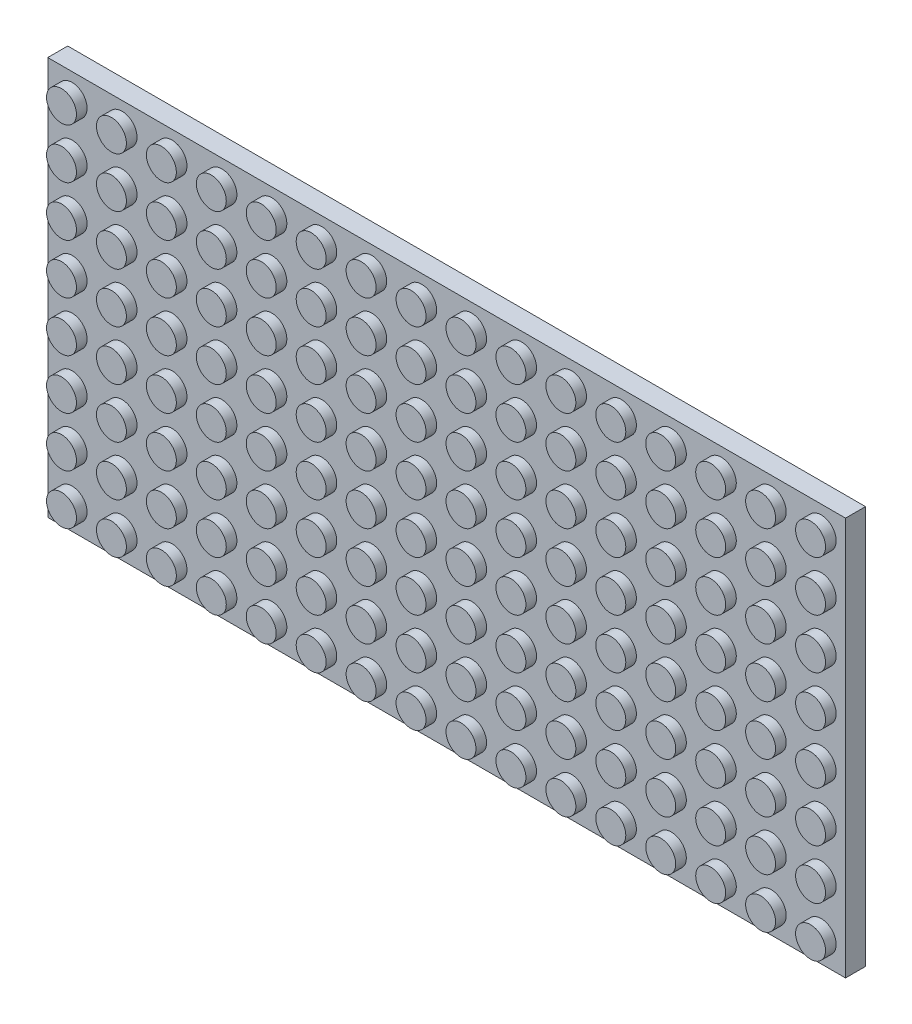
from build123d import *

# Parameters (mm, degrees)
SKETCH_1_W          = 127.8
SKETCH_1_H          = 63.8
EXTRUDE_1_DEPTH     = 3.2
SKETCH_2_R          = 2.4
EXTRUDE_2_DEPTH     = 1.7
SKETCH_3_R          = 2.5
CUT_EXTRUDE_1_DEPTH = 1.8


with BuildPart() as part:
    # Эскиз1 → Бобышка-Вытянуть1 (new body)
    with BuildSketch(Plane.XY):
        Rectangle(SKETCH_1_W, SKETCH_1_H)
    extrude(amount=EXTRUDE_1_DEPTH)

    # Эскиз2 → Бобышка-Вытянуть2 (add)
    with BuildSketch(Plane.XY.offset(3.2)):
        with Locations(Location((-60, 28, 0), (0, 0, 180))):
            Circle(SKETCH_2_R)
        with Locations(Location((-52, 28, 0), (0, 0, 180))):
            Circle(SKETCH_2_R)
        with Locations(Location((-44, 28, 0), (0, 0, 180))):
            Circle(SKETCH_2_R)
        with Locations(Location((-36, 28, 0), (0, 0, 180))):
            Circle(SKETCH_2_R)
        with Locations(Location((-28, 28, 0), (0, 0, 180))):
            Circle(SKETCH_2_R)
        with Locations(Location((-20, 28, 0), (0, 0, 180))):
            Circle(SKETCH_2_R)
        with Locations(Location((-12, 28, 0), (0, 0, 180))):
            Circle(SKETCH_2_R)
        with Locations(Location((-4, 28, 0), (0, 0, 180))):
            Circle(SKETCH_2_R)
        with Locations(Location((4, 28, 0), (0, 0, 180))):
            Circle(SKETCH_2_R)
        with Locations(Location((12, 28, 0), (0, 0, 180))):
            Circle(SKETCH_2_R)
        with Locations(Location((20, 28, 0), (0, 0, 180))):
            Circle(SKETCH_2_R)
        with Locations(Location((28, 28, 0), (0, 0, 180))):
            Circle(SKETCH_2_R)
        with Locations(Location((36, 28, 0), (0, 0, 180))):
            Circle(SKETCH_2_R)
        with Locations(Location((44, 28, 0), (0, 0, 180))):
            Circle(SKETCH_2_R)
        with Locations(Location((52, 28, 0), (0, 0, 180))):
            Circle(SKETCH_2_R)
        with Locations(Location((60, 28, 0), (0, 0, 180))):
            Circle(SKETCH_2_R)
        with Locations(Location((-52, 20, 0), (0, 0, 180))):
            Circle(SKETCH_2_R)
        with Locations(Location((-44, 20, 0), (0, 0, 180))):
            Circle(SKETCH_2_R)
        with Locations(Location((-36, 20, 0), (0, 0, 180))):
            Circle(SKETCH_2_R)
        with Locations(Location((-28, 20, 0), (0, 0, 180))):
            Circle(SKETCH_2_R)
        with Locations(Location((-20, 20, 0), (0, 0, 180))):
            Circle(SKETCH_2_R)
        with Locations(Location((-12, 20, 0), (0, 0, 180))):
            Circle(SKETCH_2_R)
        with Locations(Location((-4, 20, 0), (0, 0, 180))):
            Circle(SKETCH_2_R)
        with Locations(Location((4, 20, 0), (0, 0, 180))):
            Circle(SKETCH_2_R)
        with Locations(Location((12, 20, 0), (0, 0, 180))):
            Circle(SKETCH_2_R)
        with Locations(Location((20, 20, 0), (0, 0, 180))):
            Circle(SKETCH_2_R)
        with Locations(Location((28, 20, 0), (0, 0, 180))):
            Circle(SKETCH_2_R)
        with Locations(Location((36, 20, 0), (0, 0, 180))):
            Circle(SKETCH_2_R)
        with Locations(Location((44, 20, 0), (0, 0, 180))):
            Circle(SKETCH_2_R)
        with Locations(Location((52, 20, 0), (0, 0, 180))):
            Circle(SKETCH_2_R)
        with Locations(Location((60, 20, 0), (0, 0, 180))):
            Circle(SKETCH_2_R)
        with Locations(Location((-52, 12, 0), (0, 0, 180))):
            Circle(SKETCH_2_R)
        with Locations(Location((-44, 12, 0), (0, 0, 180))):
            Circle(SKETCH_2_R)
        with Locations(Location((-36, 12, 0), (0, 0, 180))):
            Circle(SKETCH_2_R)
        with Locations(Location((-28, 12, 0), (0, 0, 180))):
            Circle(SKETCH_2_R)
        with Locations(Location((-20, 12, 0), (0, 0, 180))):
            Circle(SKETCH_2_R)
        with Locations(Location((-12, 12, 0), (0, 0, 180))):
            Circle(SKETCH_2_R)
        with Locations(Location((-4, 12, 0), (0, 0, 180))):
            Circle(SKETCH_2_R)
        with Locations(Location((4, 12, 0), (0, 0, 180))):
            Circle(SKETCH_2_R)
        with Locations(Location((12, 12, 0), (0, 0, 180))):
            Circle(SKETCH_2_R)
        with Locations(Location((20, 12, 0), (0, 0, 180))):
            Circle(SKETCH_2_R)
        with Locations(Location((28, 12, 0), (0, 0, 180))):
            Circle(SKETCH_2_R)
        with Locations(Location((36, 12, 0), (0, 0, 180))):
            Circle(SKETCH_2_R)
        with Locations(Location((44, 12, 0), (0, 0, 180))):
            Circle(SKETCH_2_R)
        with Locations(Location((52, 12, 0), (0, 0, 180))):
            Circle(SKETCH_2_R)
        with Locations(Location((60, 12, 0), (0, 0, 180))):
            Circle(SKETCH_2_R)
        with Locations(Location((-52, 4, 0), (0, 0, 180))):
            Circle(SKETCH_2_R)
        with Locations(Location((-44, 4, 0), (0, 0, 180))):
            Circle(SKETCH_2_R)
        with Locations(Location((-36, 4, 0), (0, 0, 180))):
            Circle(SKETCH_2_R)
        with Locations(Location((-28, 4, 0), (0, 0, 180))):
            Circle(SKETCH_2_R)
        with Locations(Location((-20, 4, 0), (0, 0, 180))):
            Circle(SKETCH_2_R)
        with Locations(Location((-12, 4, 0), (0, 0, 180))):
            Circle(SKETCH_2_R)
        with Locations(Location((-4, 4, 0), (0, 0, 180))):
            Circle(SKETCH_2_R)
        with Locations(Location((4, 4, 0), (0, 0, 180))):
            Circle(SKETCH_2_R)
        with Locations(Location((12, 4, 0), (0, 0, 180))):
            Circle(SKETCH_2_R)
        with Locations(Location((20, 4, 0), (0, 0, 180))):
            Circle(SKETCH_2_R)
        with Locations(Location((28, 4, 0), (0, 0, 180))):
            Circle(SKETCH_2_R)
        with Locations(Location((36, 4, 0), (0, 0, 180))):
            Circle(SKETCH_2_R)
        with Locations(Location((44, 4, 0), (0, 0, 180))):
            Circle(SKETCH_2_R)
        with Locations(Location((52, 4, 0), (0, 0, 180))):
            Circle(SKETCH_2_R)
        with Locations(Location((60, 4, 0), (0, 0, 180))):
            Circle(SKETCH_2_R)
        with Locations(Location((-52, -4, 0), (0, 0, 180))):
            Circle(SKETCH_2_R)
        with Locations(Location((-44, -4, 0), (0, 0, 180))):
            Circle(SKETCH_2_R)
        with Locations(Location((-36, -4, 0), (0, 0, 180))):
            Circle(SKETCH_2_R)
        with Locations(Location((-28, -4, 0), (0, 0, 180))):
            Circle(SKETCH_2_R)
        with Locations(Location((-20, -4, 0), (0, 0, 180))):
            Circle(SKETCH_2_R)
        with Locations(Location((-12, -4, 0), (0, 0, 180))):
            Circle(SKETCH_2_R)
        with Locations(Location((-4, -4, 0), (0, 0, 180))):
            Circle(SKETCH_2_R)
        with Locations(Location((4, -4, 0), (0, 0, 180))):
            Circle(SKETCH_2_R)
        with Locations(Location((12, -4, 0), (0, 0, 180))):
            Circle(SKETCH_2_R)
        with Locations(Location((20, -4, 0), (0, 0, 180))):
            Circle(SKETCH_2_R)
        with Locations(Location((28, -4, 0), (0, 0, 180))):
            Circle(SKETCH_2_R)
        with Locations(Location((36, -4, 0), (0, 0, 180))):
            Circle(SKETCH_2_R)
        with Locations(Location((44, -4, 0), (0, 0, 180))):
            Circle(SKETCH_2_R)
        with Locations(Location((52, -4, 0), (0, 0, 180))):
            Circle(SKETCH_2_R)
        with Locations(Location((60, -4, 0), (0, 0, 180))):
            Circle(SKETCH_2_R)
        with Locations(Location((-52, -12, 0), (0, 0, 180))):
            Circle(SKETCH_2_R)
        with Locations(Location((-44, -12, 0), (0, 0, 180))):
            Circle(SKETCH_2_R)
        with Locations(Location((-36, -12, 0), (0, 0, 180))):
            Circle(SKETCH_2_R)
        with Locations(Location((-28, -12, 0), (0, 0, 180))):
            Circle(SKETCH_2_R)
        with Locations(Location((-20, -12, 0), (0, 0, 180))):
            Circle(SKETCH_2_R)
        with Locations(Location((-12, -12, 0), (0, 0, 180))):
            Circle(SKETCH_2_R)
        with Locations(Location((-4, -12, 0), (0, 0, 180))):
            Circle(SKETCH_2_R)
        with Locations(Location((4, -12, 0), (0, 0, 180))):
            Circle(SKETCH_2_R)
        with Locations(Location((12, -12, 0), (0, 0, 180))):
            Circle(SKETCH_2_R)
        with Locations(Location((20, -12, 0), (0, 0, 180))):
            Circle(SKETCH_2_R)
        with Locations(Location((28, -12, 0), (0, 0, 180))):
            Circle(SKETCH_2_R)
        with Locations(Location((36, -12, 0), (0, 0, 180))):
            Circle(SKETCH_2_R)
        with Locations(Location((44, -12, 0), (0, 0, 180))):
            Circle(SKETCH_2_R)
        with Locations(Location((52, -12, 0), (0, 0, 180))):
            Circle(SKETCH_2_R)
        with Locations(Location((60, -12, 0), (0, 0, 180))):
            Circle(SKETCH_2_R)
        with Locations(Location((-52, -20, 0), (0, 0, 180))):
            Circle(SKETCH_2_R)
        with Locations(Location((-44, -20, 0), (0, 0, 180))):
            Circle(SKETCH_2_R)
        with Locations(Location((-36, -20, 0), (0, 0, 180))):
            Circle(SKETCH_2_R)
        with Locations(Location((-28, -20, 0), (0, 0, 180))):
            Circle(SKETCH_2_R)
        with Locations(Location((-20, -20, 0), (0, 0, 180))):
            Circle(SKETCH_2_R)
        with Locations(Location((-12, -20, 0), (0, 0, 180))):
            Circle(SKETCH_2_R)
        with Locations(Location((-4, -20, 0), (0, 0, 180))):
            Circle(SKETCH_2_R)
        with Locations(Location((4, -20, 0), (0, 0, 180))):
            Circle(SKETCH_2_R)
        with Locations(Location((12, -20, 0), (0, 0, 180))):
            Circle(SKETCH_2_R)
        with Locations(Location((20, -20, 0), (0, 0, 180))):
            Circle(SKETCH_2_R)
        with Locations(Location((28, -20, 0), (0, 0, 180))):
            Circle(SKETCH_2_R)
        with Locations(Location((36, -20, 0), (0, 0, 180))):
            Circle(SKETCH_2_R)
        with Locations(Location((44, -20, 0), (0, 0, 180))):
            Circle(SKETCH_2_R)
        with Locations(Location((52, -20, 0), (0, 0, 180))):
            Circle(SKETCH_2_R)
        with Locations(Location((60, -20, 0), (0, 0, 180))):
            Circle(SKETCH_2_R)
        with Locations(Location((-52, -28, 0), (0, 0, 180))):
            Circle(SKETCH_2_R)
        with Locations(Location((-44, -28, 0), (0, 0, 180))):
            Circle(SKETCH_2_R)
        with Locations(Location((-36, -28, 0), (0, 0, 180))):
            Circle(SKETCH_2_R)
        with Locations(Location((-28, -28, 0), (0, 0, 180))):
            Circle(SKETCH_2_R)
        with Locations(Location((-20, -28, 0), (0, 0, 180))):
            Circle(SKETCH_2_R)
        with Locations(Location((-12, -28, 0), (0, 0, 180))):
            Circle(SKETCH_2_R)
        with Locations(Location((-4, -28, 0), (0, 0, 180))):
            Circle(SKETCH_2_R)
        with Locations(Location((4, -28, 0), (0, 0, 180))):
            Circle(SKETCH_2_R)
        with Locations(Location((12, -28, 0), (0, 0, 180))):
            Circle(SKETCH_2_R)
        with Locations(Location((20, -28, 0), (0, 0, 180))):
            Circle(SKETCH_2_R)
        with Locations(Location((28, -28, 0), (0, 0, 180))):
            Circle(SKETCH_2_R)
        with Locations(Location((36, -28, 0), (0, 0, 180))):
            Circle(SKETCH_2_R)
        with Locations(Location((44, -28, 0), (0, 0, 180))):
            Circle(SKETCH_2_R)
        with Locations(Location((52, -28, 0), (0, 0, 180))):
            Circle(SKETCH_2_R)
        with Locations(Location((60, -28, 0), (0, 0, 180))):
            Circle(SKETCH_2_R)
        with Locations(Location((-60, 20, 0), (0, 0, 180))):
            Circle(SKETCH_2_R)
        with Locations(Location((-60, 12, 0), (0, 0, 180))):
            Circle(SKETCH_2_R)
        with Locations(Location((-60, 4, 0), (0, 0, 180))):
            Circle(SKETCH_2_R)
        with Locations(Location((-60, -4, 0), (0, 0, 180))):
            Circle(SKETCH_2_R)
        with Locations(Location((-60, -12, 0), (0, 0, 180))):
            Circle(SKETCH_2_R)
        with Locations(Location((-60, -20, 0), (0, 0, 180))):
            Circle(SKETCH_2_R)
        with Locations(Location((-60, -28, 0), (0, 0, 180))):
            Circle(SKETCH_2_R)
    extrude(amount=EXTRUDE_2_DEPTH)

    # Эскиз3 → Вырез-Вытянуть1 (cut)
    with BuildSketch(Plane(origin=(0, 0, 0), x_dir=(-1, 0, 0), z_dir=(0, 0, -1))):
        with Locations((-60, -28)):
            Circle(SKETCH_3_R)
        with Locations((-52, -28)):
            Circle(SKETCH_3_R)
        with Locations((-44, -28)):
            Circle(SKETCH_3_R)
        with Locations((-36, -28)):
            Circle(SKETCH_3_R)
        with Locations((-28, -28)):
            Circle(SKETCH_3_R)
        with Locations((-20, -28)):
            Circle(SKETCH_3_R)
        with Locations((-12, -28)):
            Circle(SKETCH_3_R)
        with Locations((-4, -28)):
            Circle(SKETCH_3_R)
        with Locations((4, -28)):
            Circle(SKETCH_3_R)
        with Locations((12, -28)):
            Circle(SKETCH_3_R)
        with Locations((20, -28)):
            Circle(SKETCH_3_R)
        with Locations((28, -28)):
            Circle(SKETCH_3_R)
        with Locations((36, -28)):
            Circle(SKETCH_3_R)
        with Locations((44, -28)):
            Circle(SKETCH_3_R)
        with Locations((52, -28)):
            Circle(SKETCH_3_R)
        with Locations((60, -28)):
            Circle(SKETCH_3_R)
        with Locations((-52, -20)):
            Circle(SKETCH_3_R)
        with Locations((-44, -20)):
            Circle(SKETCH_3_R)
        with Locations((-36, -20)):
            Circle(SKETCH_3_R)
        with Locations((-28, -20)):
            Circle(SKETCH_3_R)
        with Locations((-20, -20)):
            Circle(SKETCH_3_R)
        with Locations((-12, -20)):
            Circle(SKETCH_3_R)
        with Locations((-4, -20)):
            Circle(SKETCH_3_R)
        with Locations((4, -20)):
            Circle(SKETCH_3_R)
        with Locations((12, -20)):
            Circle(SKETCH_3_R)
        with Locations((20, -20)):
            Circle(SKETCH_3_R)
        with Locations((28, -20)):
            Circle(SKETCH_3_R)
        with Locations((36, -20)):
            Circle(SKETCH_3_R)
        with Locations((44, -20)):
            Circle(SKETCH_3_R)
        with Locations((52, -20)):
            Circle(SKETCH_3_R)
        with Locations((60, -20)):
            Circle(SKETCH_3_R)
        with Locations((-52, -12)):
            Circle(SKETCH_3_R)
        with Locations((-44, -12)):
            Circle(SKETCH_3_R)
        with Locations((-36, -12)):
            Circle(SKETCH_3_R)
        with Locations((-28, -12)):
            Circle(SKETCH_3_R)
        with Locations((-20, -12)):
            Circle(SKETCH_3_R)
        with Locations((-12, -12)):
            Circle(SKETCH_3_R)
        with Locations((-4, -12)):
            Circle(SKETCH_3_R)
        with Locations((4, -12)):
            Circle(SKETCH_3_R)
        with Locations((12, -12)):
            Circle(SKETCH_3_R)
        with Locations((20, -12)):
            Circle(SKETCH_3_R)
        with Locations((28, -12)):
            Circle(SKETCH_3_R)
        with Locations((36, -12)):
            Circle(SKETCH_3_R)
        with Locations((44, -12)):
            Circle(SKETCH_3_R)
        with Locations((52, -12)):
            Circle(SKETCH_3_R)
        with Locations((60, -12)):
            Circle(SKETCH_3_R)
        with Locations((-52, -4)):
            Circle(SKETCH_3_R)
        with Locations((-44, -4)):
            Circle(SKETCH_3_R)
        with Locations((-36, -4)):
            Circle(SKETCH_3_R)
        with Locations((-28, -4)):
            Circle(SKETCH_3_R)
        with Locations((-20, -4)):
            Circle(SKETCH_3_R)
        with Locations((-12, -4)):
            Circle(SKETCH_3_R)
        with Locations((-4, -4)):
            Circle(SKETCH_3_R)
        with Locations((4, -4)):
            Circle(SKETCH_3_R)
        with Locations((12, -4)):
            Circle(SKETCH_3_R)
        with Locations((20, -4)):
            Circle(SKETCH_3_R)
        with Locations((28, -4)):
            Circle(SKETCH_3_R)
        with Locations((36, -4)):
            Circle(SKETCH_3_R)
        with Locations((44, -4)):
            Circle(SKETCH_3_R)
        with Locations((52, -4)):
            Circle(SKETCH_3_R)
        with Locations((60, -4)):
            Circle(SKETCH_3_R)
        with Locations((-52, 4)):
            Circle(SKETCH_3_R)
        with Locations((-44, 4)):
            Circle(SKETCH_3_R)
        with Locations((-36, 4)):
            Circle(SKETCH_3_R)
        with Locations((-28, 4)):
            Circle(SKETCH_3_R)
        with Locations((-20, 4)):
            Circle(SKETCH_3_R)
        with Locations((-12, 4)):
            Circle(SKETCH_3_R)
        with Locations((-4, 4)):
            Circle(SKETCH_3_R)
        with Locations((4, 4)):
            Circle(SKETCH_3_R)
        with Locations((12, 4)):
            Circle(SKETCH_3_R)
        with Locations((20, 4)):
            Circle(SKETCH_3_R)
        with Locations((28, 4)):
            Circle(SKETCH_3_R)
        with Locations((36, 4)):
            Circle(SKETCH_3_R)
        with Locations((44, 4)):
            Circle(SKETCH_3_R)
        with Locations((52, 4)):
            Circle(SKETCH_3_R)
        with Locations((60, 4)):
            Circle(SKETCH_3_R)
        with Locations((-52, 12)):
            Circle(SKETCH_3_R)
        with Locations((-44, 12)):
            Circle(SKETCH_3_R)
        with Locations((-36, 12)):
            Circle(SKETCH_3_R)
        with Locations((-28, 12)):
            Circle(SKETCH_3_R)
        with Locations((-20, 12)):
            Circle(SKETCH_3_R)
        with Locations((-12, 12)):
            Circle(SKETCH_3_R)
        with Locations((-4, 12)):
            Circle(SKETCH_3_R)
        with Locations((4, 12)):
            Circle(SKETCH_3_R)
        with Locations((12, 12)):
            Circle(SKETCH_3_R)
        with Locations((20, 12)):
            Circle(SKETCH_3_R)
        with Locations((28, 12)):
            Circle(SKETCH_3_R)
        with Locations((36, 12)):
            Circle(SKETCH_3_R)
        with Locations((44, 12)):
            Circle(SKETCH_3_R)
        with Locations((52, 12)):
            Circle(SKETCH_3_R)
        with Locations((60, 12)):
            Circle(SKETCH_3_R)
        with Locations((-52, 20)):
            Circle(SKETCH_3_R)
        with Locations((-44, 20)):
            Circle(SKETCH_3_R)
        with Locations((-36, 20)):
            Circle(SKETCH_3_R)
        with Locations((-28, 20)):
            Circle(SKETCH_3_R)
        with Locations((-20, 20)):
            Circle(SKETCH_3_R)
        with Locations((-12, 20)):
            Circle(SKETCH_3_R)
        with Locations((-4, 20)):
            Circle(SKETCH_3_R)
        with Locations((4, 20)):
            Circle(SKETCH_3_R)
        with Locations((12, 20)):
            Circle(SKETCH_3_R)
        with Locations((20, 20)):
            Circle(SKETCH_3_R)
        with Locations((28, 20)):
            Circle(SKETCH_3_R)
        with Locations((36, 20)):
            Circle(SKETCH_3_R)
        with Locations((44, 20)):
            Circle(SKETCH_3_R)
        with Locations((52, 20)):
            Circle(SKETCH_3_R)
        with Locations((60, 20)):
            Circle(SKETCH_3_R)
        with Locations((-52, 28)):
            Circle(SKETCH_3_R)
        with Locations((-44, 28)):
            Circle(SKETCH_3_R)
        with Locations((-36, 28)):
            Circle(SKETCH_3_R)
        with Locations((-28, 28)):
            Circle(SKETCH_3_R)
        with Locations((-20, 28)):
            Circle(SKETCH_3_R)
        with Locations((-12, 28)):
            Circle(SKETCH_3_R)
        with Locations((-4, 28)):
            Circle(SKETCH_3_R)
        with Locations((4, 28)):
            Circle(SKETCH_3_R)
        with Locations((12, 28)):
            Circle(SKETCH_3_R)
        with Locations((20, 28)):
            Circle(SKETCH_3_R)
        with Locations((28, 28)):
            Circle(SKETCH_3_R)
        with Locations((36, 28)):
            Circle(SKETCH_3_R)
        with Locations((44, 28)):
            Circle(SKETCH_3_R)
        with Locations((52, 28)):
            Circle(SKETCH_3_R)
        with Locations((60, 28)):
            Circle(SKETCH_3_R)
        with Locations((-60, -20)):
            Circle(SKETCH_3_R)
        with Locations((-60, -12)):
            Circle(SKETCH_3_R)
        with Locations((-60, -4)):
            Circle(SKETCH_3_R)
        with Locations((-60, 4)):
            Circle(SKETCH_3_R)
        with Locations((-60, 12)):
            Circle(SKETCH_3_R)
        with Locations((-60, 20)):
            Circle(SKETCH_3_R)
        with Locations((-60, 28)):
            Circle(SKETCH_3_R)
    extrude(amount=-CUT_EXTRUDE_1_DEPTH, mode=Mode.SUBTRACT)


solid = part.part
